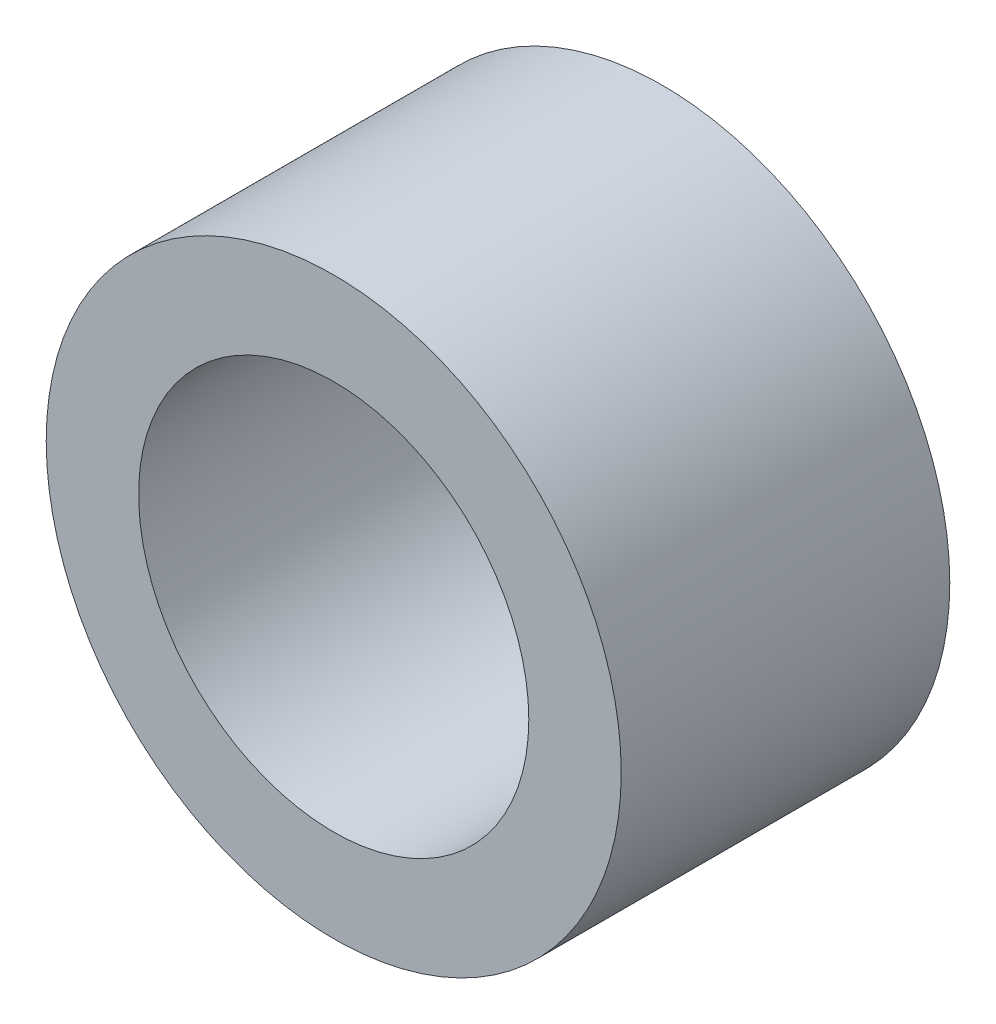
from build123d import *

# Parameters (mm, degrees)
SKETCH_1_W = 16
SKETCH_1_H = 4.5


with BuildPart() as part:
    # 草图1 → 旋转2 (revolve)
    with BuildSketch(Plane(origin=(0, 0, 0), x_dir=(0, 0, -1), z_dir=(1, 0, 0)), mode=Mode.PRIVATE) as revolve_2_sk:
        with Locations((-8, 20.75)):
            Rectangle(SKETCH_1_W, SKETCH_1_H)
    revolve(revolve_2_sk.sketch.rotate(Axis((0, 9, 28.39033539), (0, 0, -1)), 90), axis=Axis((0, 9, 28.39033539), (0, 0, -1)))


solid = part.part
